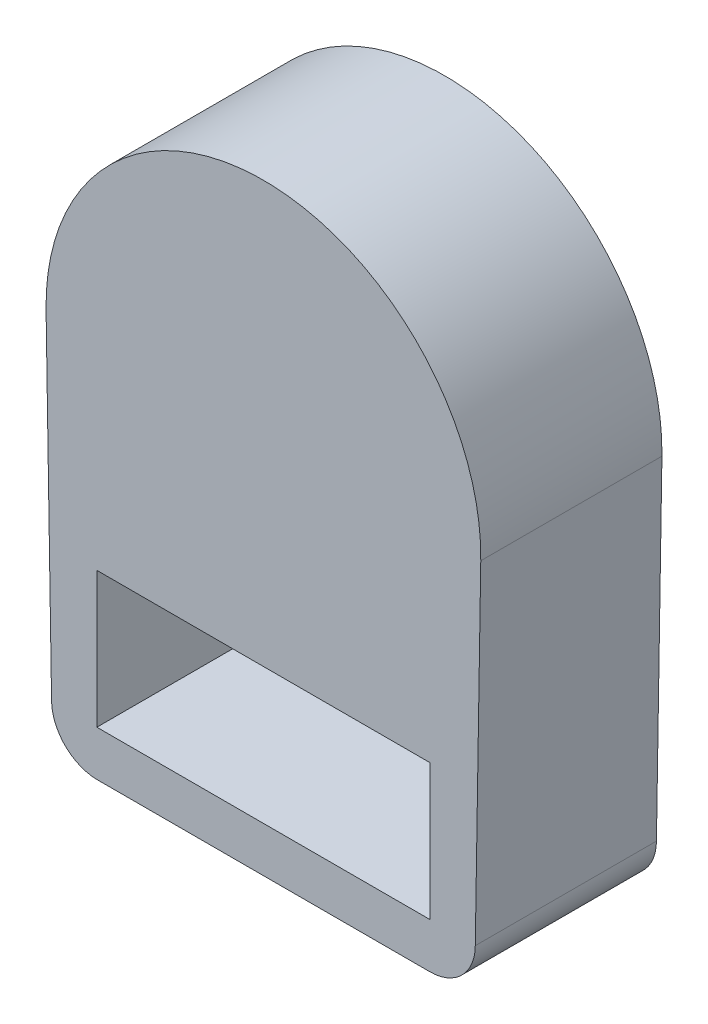
from build123d import *

# Parameters (mm, degrees)
SKETCH1_R           = 19
SKETCH1_W           = 36.78
SKETCH1_H           = 15
BOSS_EXTRUDE1_DEPTH = 15
BOSS_EXTRUDE4_DEPTH = 5


with BuildPart() as part:
    # Sketch1 → Boss-Extrude1 (new body)
    with BuildSketch(Plane.XY):
        with BuildLine():
            Line((-18.39, -12.5), (18.39, -12.5))
            ThreePointArc((18.39, -12.5), (21.925533906, -11.035533906), (23.39, -7.5))
            Line((23.39, -7.5), (23.996791899, 29.607599001))
            ThreePointArc((23.996791899, 29.607599001), (0, 54), (-23.996791899, 29.607599001))
            Line((-23.996791899, 29.607599001), (-23.39, -7.5))
            ThreePointArc((-23.39, -7.5), (-21.925533906, -11.035533906), (-18.39, -12.5))
        make_face()
        with Locations((0, 30)):
            Circle(SKETCH1_R, mode=Mode.SUBTRACT)
        Rectangle(SKETCH1_W, SKETCH1_H, mode=Mode.SUBTRACT)
    extrude(amount=BOSS_EXTRUDE1_DEPTH)

    # Sketch13 → Boss-Extrude4 (add)
    with BuildSketch(Plane.XY.offset(15)):
        with BuildLine():
            Line((-23.996791899, 29.607599001), (-23.39, -7.5))
            ThreePointArc((-23.39, -7.5), (-21.901669041, -11.011669041), (-18.39, -12.5))
            Line((-18.39, -12.5), (18.39, -12.5))
            ThreePointArc((18.39, -12.5), (21.925533906, -11.035533906), (23.39, -7.5))
            Line((23.39, -7.5), (23.996791899, 29.607599001))
            ThreePointArc((23.996791899, 29.607599001), (0, 54), (-23.996791899, 29.607599001))
        make_face()
        Polygon((-18.39, -7.5), (-18.39, 7.5), (0, 7.5), (18.39, 7.5), (18.39, -7.5), align=None, mode=Mode.SUBTRACT)
    extrude(amount=BOSS_EXTRUDE4_DEPTH)


solid = part.part
